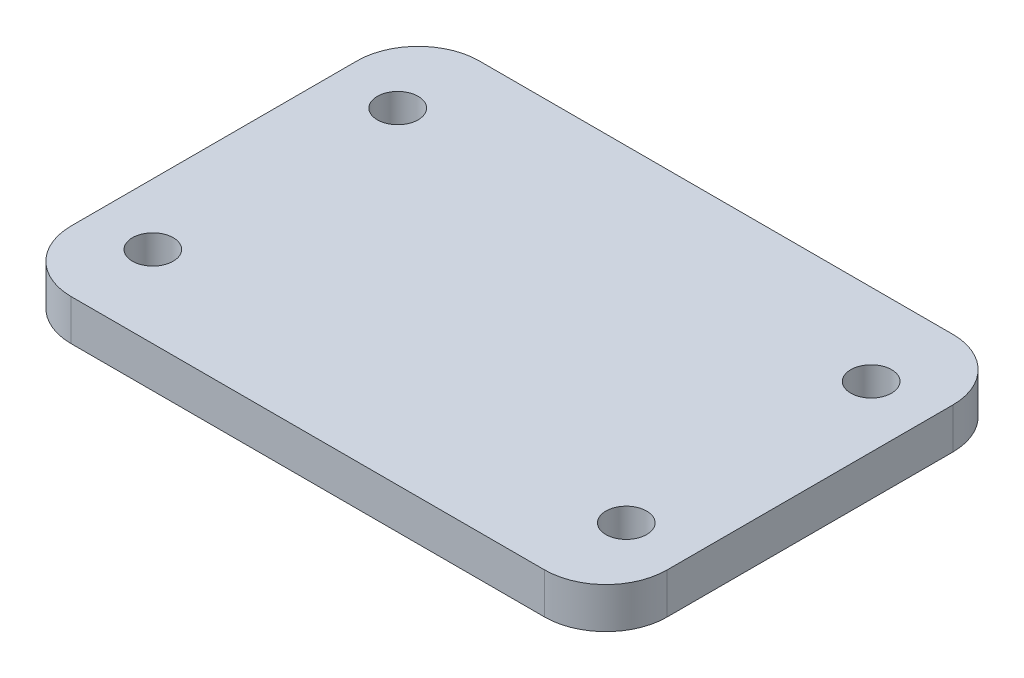
from build123d import *

# Parameters (mm, degrees)
SALIENTE_EXTRUIR1_DEPTH  = 10
CROQUIS2_R               = 5
CORTAR_EXTRUIR1_DEPTH    = 10
MATRIZL1_COUNT           = 3
MATRIZL1_PITCH           = 116
MATRIZL2_COUNT           = 3
MATRIZL2_PITCH           = 60
MATRIZL2_COPY_1_SKETCH_R = 5
MATRIZL2_COPY_1_DEPTH    = 10
MATRIZL2_COPY_2_SKETCH_R = 5
MATRIZL2_COPY_2_DEPTH    = 10
MATRIZL2_COPY_3_SKETCH_R = 5
MATRIZL2_COPY_3_DEPTH    = 10
MATRIZL2_COPY_4_SKETCH_R = 5
MATRIZL2_COPY_4_DEPTH    = 10


with BuildPart() as part:
    # Croquis1 → Saliente-Extruir1 (new body)
    with BuildSketch(Plane(origin=(0, 0, 0), x_dir=(1, 0, 0), z_dir=(0, 1, 0))):
        with BuildLine():
            Line((58, -50), (-58, -50))
            ThreePointArc((-58, -50), (-68.606601718, -45.606601718), (-73, -35))
            Line((-73, -35), (-73, 35))
            ThreePointArc((-73, 35), (-68.606601718, 45.606601718), (-58, 50))
            Line((-58, 50), (58, 50))
            ThreePointArc((58, 50), (68.606601718, 45.606601718), (73, 35))
            Line((73, 35), (73, -35))
            ThreePointArc((73, -35), (68.606601718, -45.606601718), (58, -50))
        make_face()
    extrude(amount=SALIENTE_EXTRUIR1_DEPTH)

    # Croquis2 → Cortar-Extruir1 (cut)
    with BuildSketch(Plane(origin=(0, 10, 0), x_dir=(1, 0, 0), z_dir=(0, 1, 0))):
        with Locations(Location((-58, 30, 0), (0, 0, 270))):
            Circle(CROQUIS2_R)
    cortar_extruir1 = extrude(amount=-CORTAR_EXTRUIR1_DEPTH, mode=Mode.SUBTRACT)

    # MatrizL1: Cortar-Extruir1 ×3
    with Locations(*[(i * MATRIZL1_PITCH, 0, 0) for i in range(1, MATRIZL1_COUNT)]):
        add(cortar_extruir1, mode=Mode.SUBTRACT)

    # MatrizL2: Cortar-Extruir1 ×3
    with Locations(*[(0, 0, i * MATRIZL2_PITCH) for i in range(1, MATRIZL2_COUNT)]):
        add(cortar_extruir1, mode=Mode.SUBTRACT)

    # MatrizL2 copy 1 sketch → MatrizL2 copy 1 (cut)
    with BuildSketch(Plane(origin=(116, 10, 60), x_dir=(1, 0, 0), z_dir=(0, 1, 0))):
        with Locations(Location((-58, 30, 0), (0, 0, 270))):
            Circle(MATRIZL2_COPY_1_SKETCH_R)
    extrude(amount=-MATRIZL2_COPY_1_DEPTH, mode=Mode.SUBTRACT)

    # MatrizL2 copy 2 sketch → MatrizL2 copy 2 (cut)
    with BuildSketch(Plane(origin=(116, 10, 120), x_dir=(1, 0, 0), z_dir=(0, 1, 0))):
        with Locations(Location((-58, 30, 0), (0, 0, 270))):
            Circle(MATRIZL2_COPY_2_SKETCH_R)
    extrude(amount=-MATRIZL2_COPY_2_DEPTH, mode=Mode.SUBTRACT)

    # MatrizL2 copy 3 sketch → MatrizL2 copy 3 (cut)
    with BuildSketch(Plane(origin=(232, 10, 60), x_dir=(1, 0, 0), z_dir=(0, 1, 0))):
        with Locations(Location((-58, 30, 0), (0, 0, 270))):
            Circle(MATRIZL2_COPY_3_SKETCH_R)
    extrude(amount=-MATRIZL2_COPY_3_DEPTH, mode=Mode.SUBTRACT)

    # MatrizL2 copy 4 sketch → MatrizL2 copy 4 (cut)
    with BuildSketch(Plane(origin=(232, 10, 120), x_dir=(1, 0, 0), z_dir=(0, 1, 0))):
        with Locations(Location((-58, 30, 0), (0, 0, 270))):
            Circle(MATRIZL2_COPY_4_SKETCH_R)
    extrude(amount=-MATRIZL2_COPY_4_DEPTH, mode=Mode.SUBTRACT)


solid = part.part
